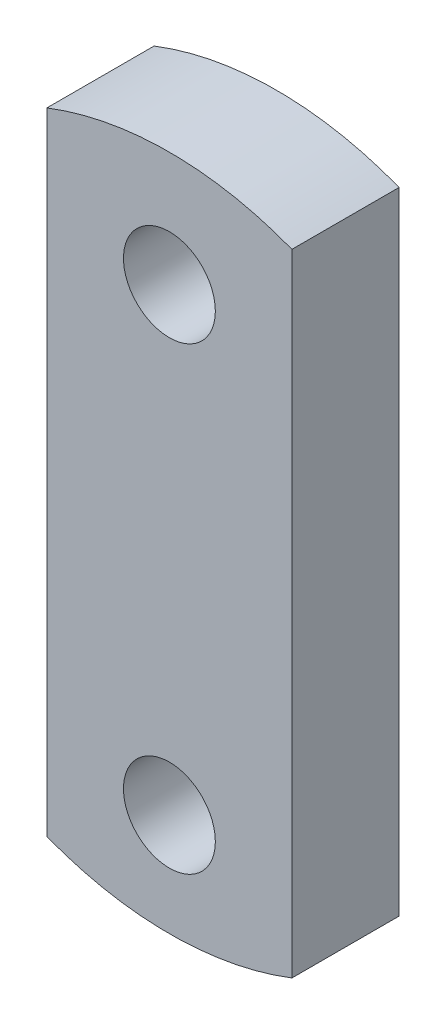
from build123d import *

# Parameters (mm, degrees)
BOSS_EXTRUDE1_DEPTH     = 35
CUT_EXTRUDE1_DEPTH      = 125.410698055
CUT_EXTRUDE1_DEPTH_BACK = 125.410698055
SKETCH2_R               = 15
CUT_EXTRUDE2_DEPTH      = 125.410698055
CUT_EXTRUDE2_DEPTH_BACK = 125.410698055
SKETCH3_R               = 15


with BuildPart() as part:
    # Sketch1 → Boss-Extrude1 (new body)
    with BuildSketch(Plane.XY):
        with BuildLine():
            Line((-40, -101.071410351), (-40, 104.993508703))
            ThreePointArc((-40, 104.993508703), (0, 112.485651488), (40, 104.993508703))
            Line((40, 104.993508703), (40, -101.071410351))
            ThreePointArc((40, -101.071410351), (0, -108.563553136), (-40, -101.071410351))
        make_face()
    extrude(amount=BOSS_EXTRUDE1_DEPTH)

    # Sketch2 → Cut-Extrude1 (cut, two sides: drawn at the far end of the back side and taken through both)
    with BuildSketch(Plane.XY.offset(-CUT_EXTRUDE1_DEPTH_BACK)):
        with Locations((0, 74.993508703)):
            Circle(SKETCH2_R)
    extrude(amount=CUT_EXTRUDE1_DEPTH + CUT_EXTRUDE1_DEPTH_BACK, mode=Mode.SUBTRACT)

    # Sketch3 → Cut-Extrude2 (cut, two sides: drawn at the far end of the back side and taken through both)
    with BuildSketch(Plane.XY.offset(-CUT_EXTRUDE2_DEPTH_BACK)):
        with Locations((0, -75.006491297)):
            Circle(SKETCH3_R)
    extrude(amount=CUT_EXTRUDE2_DEPTH + CUT_EXTRUDE2_DEPTH_BACK, mode=Mode.SUBTRACT)


solid = part.part
